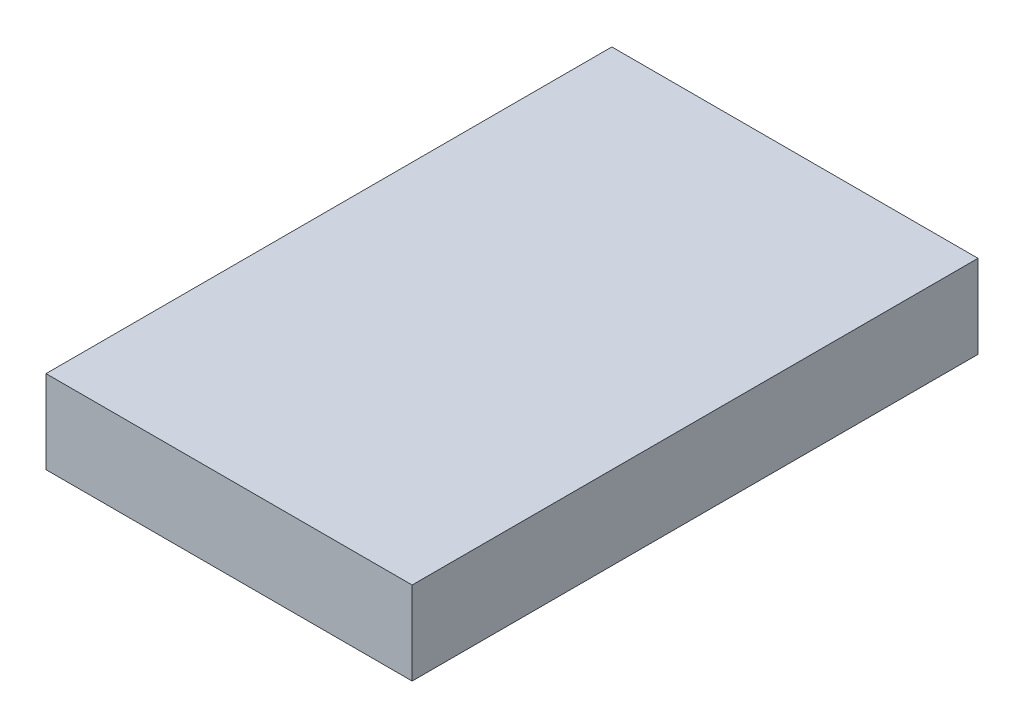
from build123d import *

# Parameters (mm, degrees)
SKETCH2_W           = 11
SKETCH2_H           = 17
BOSS_EXTRUDE1_DEPTH = 2.5


with BuildPart() as part:
    # Sketch2 → Boss-Extrude1 (new body)
    with BuildSketch(Plane(origin=(0, 0, 0), x_dir=(1, 0, 0), z_dir=(0, 1, 0))):
        with Locations((26.456568583, 30.188160576)):
            Rectangle(SKETCH2_W, SKETCH2_H)
    extrude(amount=BOSS_EXTRUDE1_DEPTH)


solid = part.part
